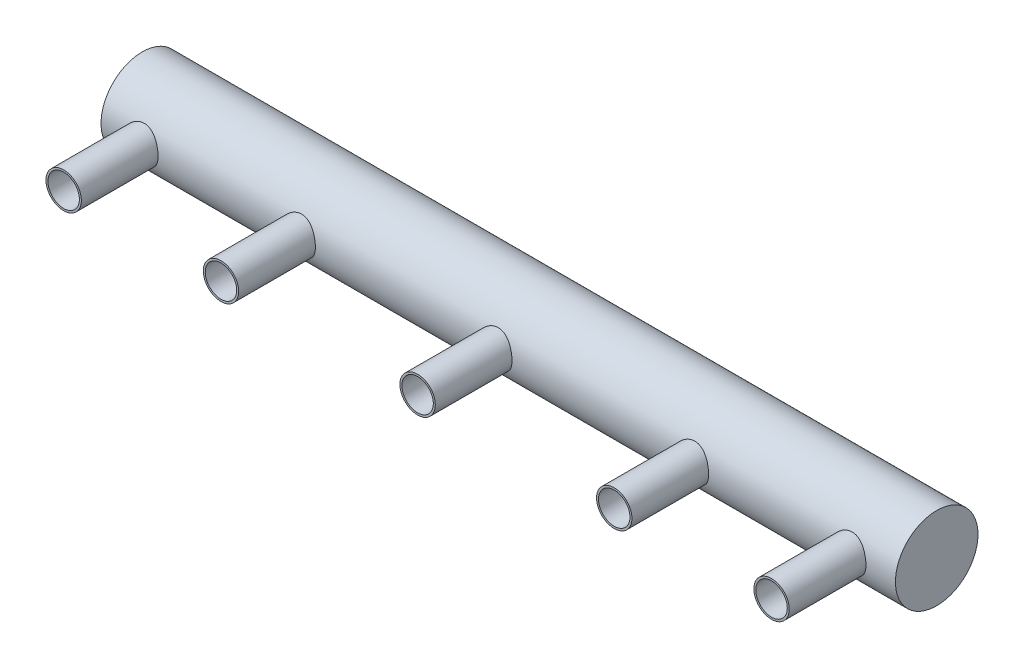
from build123d import *

# Parameters (mm, degrees)
SKETCH1_R           = 52.5
SKETCH1_R_2         = 50
BOSS_EXTRUDE2_DEPTH = 500
SKETCH2_R           = 22.5
SKETCH2_R_2         = 20
BOSS_EXTRUDE3_DEPTH = 150
CUT_EXTRUDE1_START  = -150
SKETCH3_R           = 20
CUT_EXTRUDE1_DEPTH  = 150
SKETCH4_R           = 50
CUT_EXTRUDE2_DEPTH  = 1013.549381631
BOSS_EXTRUDE4_START = 10
SKETCH5_R           = 52.5
BOSS_EXTRUDE4_DEPTH = 10


with BuildPart() as part:
    # Sketch1 → Boss-Extrude2 (new, symmetric)
    with BuildSketch(Plane(origin=(0, 0, 0), x_dir=(0, 0, -1), z_dir=(1, 0, 0))):
        Circle(SKETCH1_R)
        Circle(SKETCH1_R_2, mode=Mode.SUBTRACT)
    extrude(amount=BOSS_EXTRUDE2_DEPTH, both=True)

    # Sketch2 → Boss-Extrude3 (add)
    # profile 1 of 5: a face of its own
    with BuildSketch(Plane.XY):
        with Locations((-450, 0)):
            Circle(SKETCH2_R)
        with Locations((-450, 0)):
            Circle(SKETCH2_R_2, mode=Mode.SUBTRACT)
    # profile 2 of 5: a face of its own
    with BuildSketch(Plane.XY):
        with Locations((450, 0)):
            Circle(SKETCH2_R)
        with Locations((450, 0)):
            Circle(SKETCH2_R_2, mode=Mode.SUBTRACT)
    # profile 3 of 5: a face of its own
    with BuildSketch(Plane.XY):
        with Locations((-250, 0)):
            Circle(SKETCH2_R)
        with Locations((-250, 0)):
            Circle(SKETCH2_R_2, mode=Mode.SUBTRACT)
    # profile 4 of 5: a face of its own
    with BuildSketch(Plane.XY):
        with Locations((250, 0)):
            Circle(SKETCH2_R)
        with Locations((250, 0)):
            Circle(SKETCH2_R_2, mode=Mode.SUBTRACT)
    # profile 5 of 5: a face of its own
    with BuildSketch(Plane.XY):
        Circle(SKETCH2_R)
        Circle(SKETCH2_R_2, mode=Mode.SUBTRACT)
    extrude(amount=BOSS_EXTRUDE3_DEPTH)

    # Sketch3 → Cut-Extrude1 (cut)
    with BuildSketch(Plane.XY.offset(150).offset(CUT_EXTRUDE1_START)):
        with Locations((-450, 0)):
            Circle(SKETCH3_R)
        with Locations((-250, 0)):
            Circle(SKETCH3_R)
        Circle(SKETCH3_R)
        with Locations((250, 0)):
            Circle(SKETCH3_R)
        with Locations((450, 0)):
            Circle(SKETCH3_R)
    extrude(amount=CUT_EXTRUDE1_DEPTH, mode=Mode.SUBTRACT)

    # Sketch4 → Cut-Extrude2 (cut, through all)
    with BuildSketch(Plane.ZY.offset(500)):
        with Locations(Location((0, 0, 0), (0, 0, 180))):
            Circle(SKETCH4_R)
    extrude(amount=-CUT_EXTRUDE2_DEPTH, mode=Mode.SUBTRACT)

    # Sketch5 → Boss-Extrude4 (add)
    with BuildSketch(Plane(origin=(500, 0, 0), x_dir=(0, 0, -1), z_dir=(1, 0, 0)).offset(BOSS_EXTRUDE4_START)):
        Circle(SKETCH5_R)
    extrude(amount=-BOSS_EXTRUDE4_DEPTH)


solid = part.part
